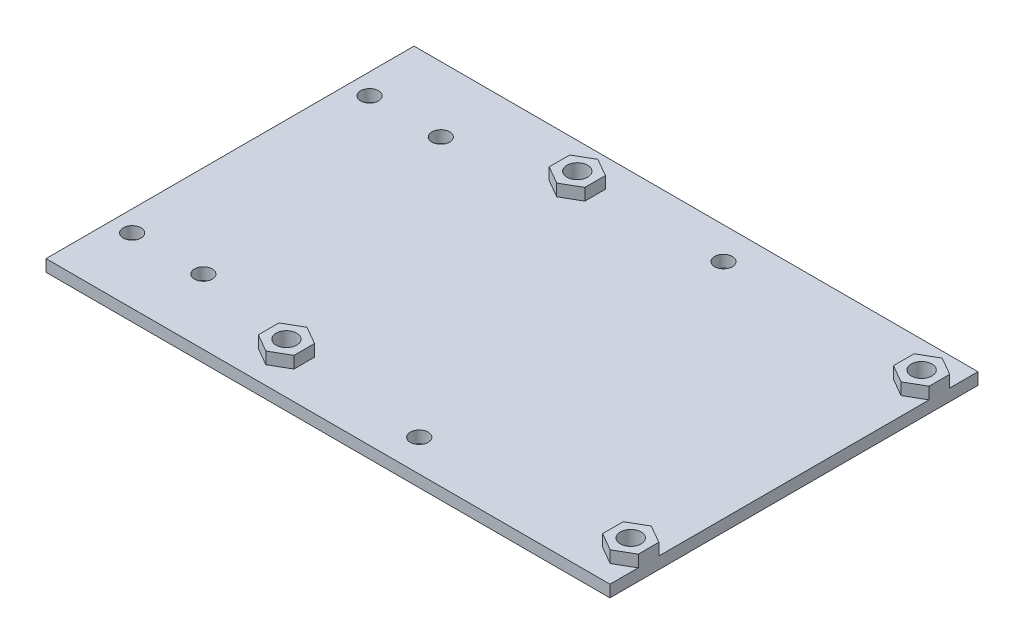
from build123d import *

# Parameters (mm, degrees)
CROQUIS1_W              = 95
CROQUIS1_H              = 62
CROQUIS1_R              = 1.5
CROQUIS1_R_2            = 1.75
SALIENTE_EXTRUIR1_DEPTH = 2
CROQUIS1_4_R            = 1.75
SALIENTE_EXTRUIR2_DEPTH = 4


with BuildPart() as part:
    # Croquis1 → Saliente-Extruir1 (new body)
    with BuildSketch(Plane(origin=(0, 0, 0), x_dir=(1, 0, 0), z_dir=(0, 1, 0))):
        Rectangle(CROQUIS1_W, CROQUIS1_H)
        with Locations((-43.99, -20)):
            Circle(CROQUIS1_R, mode=Mode.SUBTRACT)
        with Locations((-31.99, -20)):
            Circle(CROQUIS1_R, mode=Mode.SUBTRACT)
        with Locations((10, -25.63)):
            Circle(CROQUIS1_R, mode=Mode.SUBTRACT)
        with Locations((-43.99, 20)):
            Circle(CROQUIS1_R, mode=Mode.SUBTRACT)
        with Locations((-31.99, 20)):
            Circle(CROQUIS1_R, mode=Mode.SUBTRACT)
        with Locations((10, 25.63)):
            Circle(CROQUIS1_R, mode=Mode.SUBTRACT)
        with Locations((44.5, 24.5)):
            Circle(CROQUIS1_R_2, mode=Mode.SUBTRACT)
        with Locations((44.5, -24.5)):
            Circle(CROQUIS1_R_2, mode=Mode.SUBTRACT)
        with Locations((-13.5, -24.5)):
            Circle(CROQUIS1_R_2, mode=Mode.SUBTRACT)
        with Locations((-13.5, 24.5)):
            Circle(CROQUIS1_R_2, mode=Mode.SUBTRACT)
    extrude(amount=SALIENTE_EXTRUIR1_DEPTH)

    # Croquis1<4> → Saliente-Extruir2 (add)
    # profile 1 of 4: a face of its own
    with BuildSketch(Plane(origin=(0, 0, 0), x_dir=(1, 0, 0), z_dir=(0, 1, 0))):
        Polygon((47.5, 22.767949192), (47.5, 26.232050808), (44.5, 27.964101615), (41.5, 26.232050808), (41.5, 22.767949192), (44.5, 21.035898385), align=None)
        with Locations((44.5, 24.5)):
            Circle(CROQUIS1_4_R, mode=Mode.SUBTRACT)
    # profile 2 of 4: a face of its own
    with BuildSketch(Plane(origin=(0, 0, 0), x_dir=(1, 0, 0), z_dir=(0, 1, 0))):
        Polygon((44.5, -27.964101615), (47.5, -26.232050808), (47.5, -22.767949192), (44.5, -21.035898385), (41.5, -22.767949192), (41.5, -26.232050808), align=None)
        with Locations((44.5, -24.5)):
            Circle(CROQUIS1_4_R, mode=Mode.SUBTRACT)
    # profile 3 of 4: a face of its own
    with BuildSketch(Plane(origin=(0, 0, 0), x_dir=(1, 0, 0), z_dir=(0, 1, 0))):
        Polygon((-13.5, 21.035898385), (-10.5, 22.767949192), (-10.5, 26.232050808), (-13.5, 27.964101615), (-16.5, 26.232050808), (-16.5, 22.767949192), align=None)
        with Locations((-13.5, 24.5)):
            Circle(CROQUIS1_4_R, mode=Mode.SUBTRACT)
    # profile 4 of 4: a face of its own
    with BuildSketch(Plane(origin=(0, 0, 0), x_dir=(1, 0, 0), z_dir=(0, 1, 0))):
        Polygon((-13.5, -27.964101615), (-10.5, -26.232050808), (-10.5, -22.767949192), (-13.5, -21.035898385), (-16.5, -22.767949192), (-16.5, -26.232050808), align=None)
        with Locations((-13.5, -24.5)):
            Circle(CROQUIS1_4_R, mode=Mode.SUBTRACT)
    extrude(amount=SALIENTE_EXTRUIR2_DEPTH)


solid = part.part
